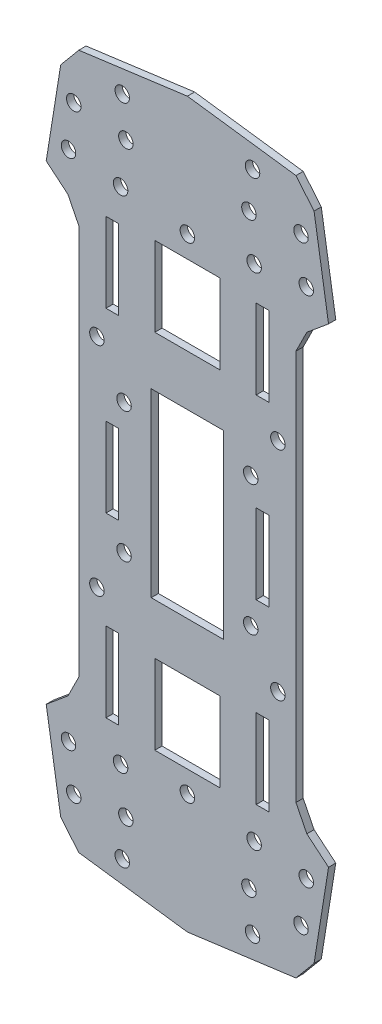
from build123d import *

# Parameters (mm, degrees)
SKETCH1_R           = 2
SKETCH1_W           = 3.5
SKETCH1_H           = 22
SKETCH1_W_2         = 18
SKETCH1_W_3         = 20
SKETCH1_H_2         = 50
BOSS_EXTRUDE1_DEPTH = 2


with BuildPart() as part:
    # Sketch1 → Boss-Extrude1 (new body)
    with BuildSketch(Plane.XY):
        Polygon((0, -100), (-30, -96), (-35, -90), (-39, -65), (-33, -60), (-30, -54), (-30, 54), (-33, 60), (-39, 65), (-35, 90), (-30, 96), (0, 100), (30, 96), (35, 90), (39, 65), (33, 60), (30, 54), (30, -54), (33, -60), (39, -65), (35, -90), (30, -96), align=None)
        with Locations((-18, -91.5)):
            Circle(SKETCH1_R, mode=Mode.SUBTRACT)
        with Locations((-17, -81)):
            Circle(SKETCH1_R, mode=Mode.SUBTRACT)
        with Locations((-31.39400917, -82.75)):
            Circle(SKETCH1_R, mode=Mode.SUBTRACT)
        with Locations((-32.842285033, -70.837716549)):
            Circle(SKETCH1_R, mode=Mode.SUBTRACT)
        with Locations((-18.448275862, -69.087716549)):
            Circle(SKETCH1_R, mode=Mode.SUBTRACT)
        with Locations((-25, -30)):
            Circle(SKETCH1_R, mode=Mode.SUBTRACT)
        with Locations((-17.5, -18)):
            Circle(SKETCH1_R, mode=Mode.SUBTRACT)
        with Locations((0, -67)):
            Circle(SKETCH1_R, mode=Mode.SUBTRACT)
        with Locations((17.5, -18)):
            Circle(SKETCH1_R, mode=Mode.SUBTRACT)
        with Locations((25, -30)):
            Circle(SKETCH1_R, mode=Mode.SUBTRACT)
        with Locations((18.448275862, -69.087716549)):
            Circle(SKETCH1_R, mode=Mode.SUBTRACT)
        with Locations((32.842285033, -70.837716549)):
            Circle(SKETCH1_R, mode=Mode.SUBTRACT)
        with Locations((31.39400917, -82.75)):
            Circle(SKETCH1_R, mode=Mode.SUBTRACT)
        with Locations((17, -81)):
            Circle(SKETCH1_R, mode=Mode.SUBTRACT)
        with Locations((18, -91.5)):
            Circle(SKETCH1_R, mode=Mode.SUBTRACT)
        with Locations((18, 91.5)):
            Circle(SKETCH1_R, mode=Mode.SUBTRACT)
        with Locations((17, 81)):
            Circle(SKETCH1_R, mode=Mode.SUBTRACT)
        with Locations((31.39400917, 82.75)):
            Circle(SKETCH1_R, mode=Mode.SUBTRACT)
        with Locations((32.842285033, 70.837716549)):
            Circle(SKETCH1_R, mode=Mode.SUBTRACT)
        with Locations((18.448275862, 69.087716549)):
            Circle(SKETCH1_R, mode=Mode.SUBTRACT)
        with Locations((25, 30)):
            Circle(SKETCH1_R, mode=Mode.SUBTRACT)
        with Locations((17.5, 18)):
            Circle(SKETCH1_R, mode=Mode.SUBTRACT)
        with Locations((0, 67)):
            Circle(SKETCH1_R, mode=Mode.SUBTRACT)
        with Locations((-17.5, 18)):
            Circle(SKETCH1_R, mode=Mode.SUBTRACT)
        with Locations((-25, 30)):
            Circle(SKETCH1_R, mode=Mode.SUBTRACT)
        with Locations((-18.448275862, 69.087716549)):
            Circle(SKETCH1_R, mode=Mode.SUBTRACT)
        with Locations((-32.842285033, 70.837716549)):
            Circle(SKETCH1_R, mode=Mode.SUBTRACT)
        with Locations((-31.39400917, 82.75)):
            Circle(SKETCH1_R, mode=Mode.SUBTRACT)
        with Locations((-17, 81)):
            Circle(SKETCH1_R, mode=Mode.SUBTRACT)
        with Locations((-18, 91.5)):
            Circle(SKETCH1_R, mode=Mode.SUBTRACT)
        with Locations((-20.75, -49)):
            Rectangle(SKETCH1_W, SKETCH1_H, mode=Mode.SUBTRACT)
        with Locations((0, -50)):
            Rectangle(SKETCH1_W_2, SKETCH1_H, mode=Mode.SUBTRACT)
        with Locations((-20.75, 0)):
            Rectangle(SKETCH1_W, SKETCH1_H, mode=Mode.SUBTRACT)
        with Locations((20.75, 0)):
            Rectangle(SKETCH1_W, SKETCH1_H, mode=Mode.SUBTRACT)
        with Locations((20.75, -49)):
            Rectangle(SKETCH1_W, SKETCH1_H, mode=Mode.SUBTRACT)
        with Locations((20.75, 49)):
            Rectangle(SKETCH1_W, SKETCH1_H, mode=Mode.SUBTRACT)
        with Locations((0, 50)):
            Rectangle(SKETCH1_W_2, SKETCH1_H, mode=Mode.SUBTRACT)
        with Locations((-20.75, 49)):
            Rectangle(SKETCH1_W, SKETCH1_H, mode=Mode.SUBTRACT)
        Rectangle(SKETCH1_W_3, SKETCH1_H_2, mode=Mode.SUBTRACT)
    extrude(amount=BOSS_EXTRUDE1_DEPTH)


solid = part.part
